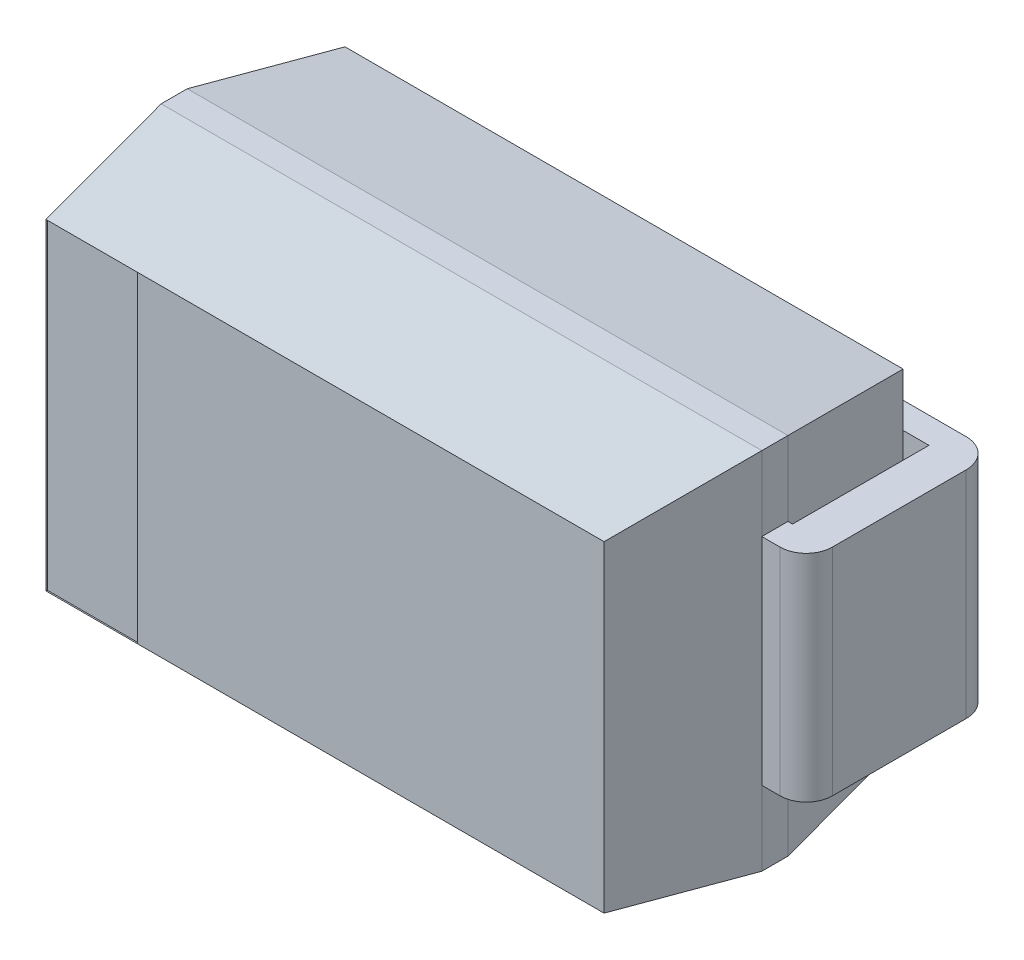
from build123d import *
from OCP.BRepFilletAPI import BRepFilletAPI_MakeChamfer

# Parameters (mm, degrees)
SKETCH_1_W           = 4.6
SKETCH_1_H           = 2.79
EXTRUDE_1_DEPTH      = 2.29
CHAMFER_1_SIZE       = 1.045
CHAMFER_1_SIZE2      = 0.163
CHAMFER_2_SIZE       = 0.163
CHAMFER_2_SIZE2      = 1.045
EXTRUDE_2_DEPTH      = 0.825
EXTRUDE_2_DEPTH_BACK = 0.825
SKETCH_3_W           = 0.7
SKETCH_3_H           = 2.464
CUT_EXTRUDE_1_DEPTH  = 0.01


with BuildPart() as part:
    # Эскиз1 → Бобышка-Вытянуть1 (new body)
    with BuildSketch(Plane.XY.offset(0.2)):
        Rectangle(SKETCH_1_W, SKETCH_1_H)
    extrude(amount=EXTRUDE_1_DEPTH)

    # Фаска1: one chamfer whose edges measure the first distance from different faces: ONE call of the kernel's chamfer builder (chamfer() names one face for all edges)
    chamfer_1_edges_1 = [part.edges().sort_by_distance(p)[0] for p in [
        (-2.3, 0, 2.49),
    ]]
    chamfer_1_side_1 = [part.faces().sort_by_distance(p)[0] for p in [
        (-2.3, 0, 1.345),
    ]]
    chamfer_1_edges_2 = [part.edges().sort_by_distance(p)[0] for p in [
        (0, -1.395, 2.49),
    ]]
    chamfer_1_side_2 = [part.faces().sort_by_distance(p)[0] for p in [
        (0, -1.395, 1.345),
    ]]
    chamfer_1_edges_3 = [part.edges().sort_by_distance(p)[0] for p in [
        (2.3, 0, 2.49),
    ]]
    chamfer_1_side_3 = [part.faces().sort_by_distance(p)[0] for p in [
        (2.3, 0, 1.345),
    ]]
    chamfer_1_edges_4 = [part.edges().sort_by_distance(p)[0] for p in [
        (0, 1.395, 2.49),
    ]]
    chamfer_1_side_4 = [part.faces().sort_by_distance(p)[0] for p in [
        (0, 1.395, 1.345),
    ]]
    chamfer_1 = BRepFilletAPI_MakeChamfer(part.part.solid().wrapped)
    for e in chamfer_1_edges_1:
        chamfer_1.Add(CHAMFER_1_SIZE, CHAMFER_1_SIZE2, e.wrapped, chamfer_1_side_1[0].wrapped)  # the first distance lies on this face
    for e in chamfer_1_edges_2:
        chamfer_1.Add(CHAMFER_1_SIZE, CHAMFER_1_SIZE2, e.wrapped, chamfer_1_side_2[0].wrapped)  # the first distance lies on this face
    for e in chamfer_1_edges_3:
        chamfer_1.Add(CHAMFER_1_SIZE, CHAMFER_1_SIZE2, e.wrapped, chamfer_1_side_3[0].wrapped)  # the first distance lies on this face
    for e in chamfer_1_edges_4:
        chamfer_1.Add(CHAMFER_1_SIZE, CHAMFER_1_SIZE2, e.wrapped, chamfer_1_side_4[0].wrapped)  # the first distance lies on this face
    add(Compound.cast(chamfer_1.Shape()), mode=Mode.REPLACE)

    # Фаска2
    chamfer_2_edges = [part.edges().sort_by_distance(p)[0] for p in [
        (0, -1.395, 0.2),
        (-2.3, 0, 0.2),
        (0, 1.395, 0.2),
        (2.3, 0, 0.2),
    ]]
    chamfer_2_side = [part.faces().sort_by_distance(p)[0] for p in [
        (0, 0, 0.2),
    ]]
    chamfer(chamfer_2_edges, length=CHAMFER_2_SIZE, length2=CHAMFER_2_SIZE2, reference=chamfer_2_side[0])

    # Эскиз3 → Вырез-Вытянуть1 (cut)
    with BuildSketch(Plane.XY.offset(2.49)):
        with Locations((-1.787, 0)):
            Rectangle(SKETCH_3_W, SKETCH_3_H)
    extrude(amount=-CUT_EXTRUDE_1_DEPTH, mode=Mode.SUBTRACT)


with BuildPart() as body_2:
    # Эскиз2 → Бобышка-Вытянуть2 (new, two sides: drawn at the far end of the back side and taken through both)
    with BuildSketch(Plane(origin=(0, 0, 0), x_dir=(1, 0, 0), z_dir=(0, 1, 0)).offset(-EXTRUDE_2_DEPTH_BACK)):
        with BuildLine():
            Line((-2.335, -0.2), (-2.335, -1.245))
            Line((-2.335, -1.245), (-2.3, -1.245))
            Line((-2.3, -1.245), (-2.3, -1.445))
            Line((-2.3, -1.445), (-2.44, -1.445))
            ThreePointArc((-2.44, -1.445), (-2.581421356, -1.386421356), (-2.64, -1.245))
            Line((-2.64, -1.245), (-2.64, -0.22))
            ThreePointArc((-2.64, -0.22), (-2.575563492, -0.064436508), (-2.42, 0))
            Line((-2.42, 0), (-1.12, 0))
            Line((-1.12, 0), (-1.12, -0.2))
            Line((-1.12, -0.2), (-2.335, -0.2))
        make_face()
    extrude(amount=EXTRUDE_2_DEPTH + EXTRUDE_2_DEPTH_BACK)


with BuildPart() as body_3:
    # Зеркальное отражение1: mirrored copy
    add(body_2.part.mirror(Plane(origin=(0, 0, 0), x_dir=(0, 0, 1), z_dir=(1, 0, 0))))


solid = Compound([part.part, body_2.part, body_3.part])
